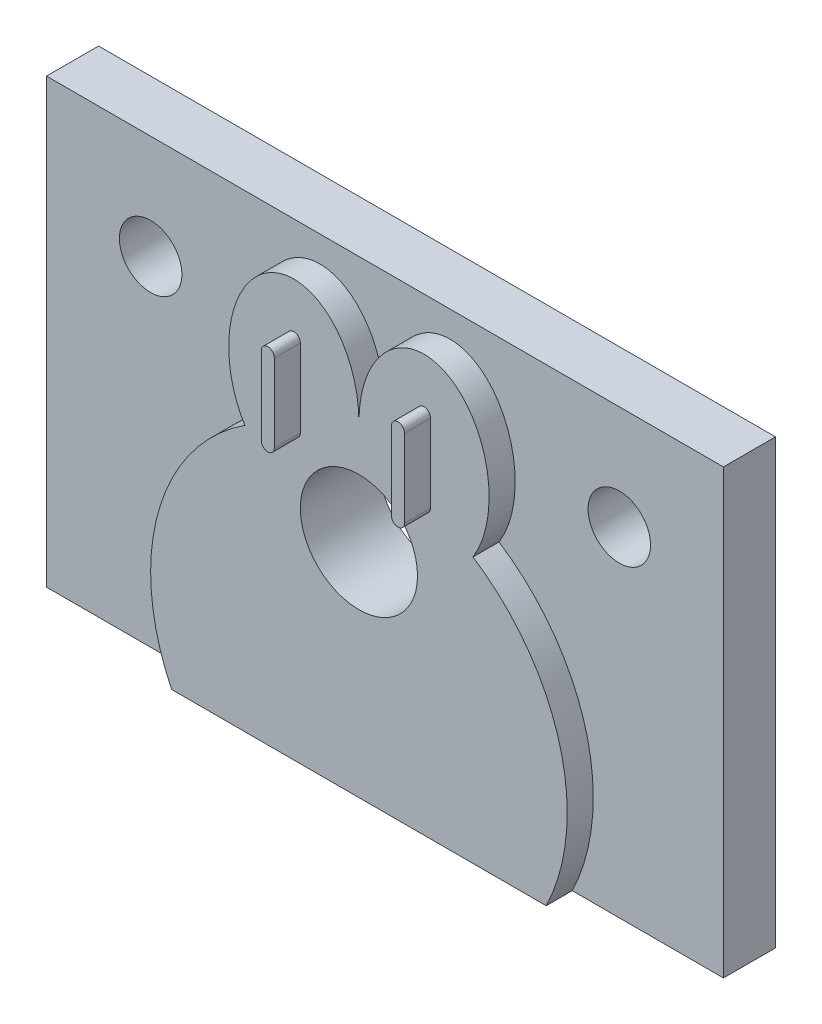
from build123d import *

# Parameters (mm, degrees)
EXTRUDE_1_DEPTH     = 1
SKETCH_2_R          = 2.25
EXTRUDE_2_DEPTH     = 1
SKETCH_4_W          = 26
SKETCH_4_H          = 17
SKETCH_4_R          = 1.2
EXTRUDE_3_DEPTH     = 2
SKETCH_5_R          = 2.25
CUT_EXTRUDE_2_DEPTH = 17.039015066


with BuildPart() as part:
    # ｽｹｯﾁ1 → ﾎﾞｽ - 押し出し1 (new body)
    with BuildSketch(Plane.XY):
        with BuildLine():
            Line((-7.193747285, -8.5), (7.193747285, -8.5))
            ThreePointArc((7.193747285, -8.5), (7.711759644, -2.871910907), (4.380673271, 1.694004907))
            add(Edge.make_bspline(
                [(4.380673271, 1.694004907), (6.759725445, 5.496905833), (3.379862723, 7.276072269), (0, 9.055238706), (0, 4)],
                knots=[0.851499657, 0.851499657, 0.851499657, 2.781944319, 2.781944319, 4.71238898, 4.71238898, 4.71238898], degree=2, weights=[1, 0.569234095, 1, 0.569234095, 1]))
            add(Edge.make_bspline(
                [(0, 4), (0, 9.055238706), (-3.379862723, 7.276072269), (-6.759725445, 5.496905833), (-4.380673271, 1.694004907)],
                knots=[1.570796327, 1.570796327, 1.570796327, 3.501240988, 3.501240988, 5.43168565, 5.43168565, 5.43168565], degree=2, weights=[1, 0.569234095, 1, 0.569234095, 1]))
            ThreePointArc((-4.380673271, 1.694004907), (-7.711759644, -2.871910907), (-7.193747285, -8.5))
        make_face()
    extrude(amount=EXTRUDE_1_DEPTH)

    # ｽｹｯﾁ2 → ﾎﾞｽ - 押し出し2 (add)
    with BuildSketch(Plane.XY.offset(1)):
        Circle(SKETCH_2_R)
        with BuildLine():
            Line((-2.75, 2.5), (-2.75, 5.5))
            ThreePointArc((-2.75, 5.5), (-2.5, 5.75), (-2.25, 5.5))
            Line((-2.25, 5.5), (-2.25, 2.5))
            ThreePointArc((-2.25, 2.5), (-2.5, 2.25), (-2.75, 2.5))
        make_face()
        with BuildLine():
            Line((2.25, 2.5), (2.25, 5.5))
            ThreePointArc((2.25, 5.5), (2.5, 5.75), (2.75, 5.5))
            Line((2.75, 5.5), (2.75, 2.5))
            ThreePointArc((2.75, 2.5), (2.5, 2.25), (2.25, 2.5))
        make_face()
    extrude(amount=EXTRUDE_2_DEPTH)

    # ｽｹｯﾁ4 → ﾎﾞｽ - 押し出し3 (add)
    with BuildSketch(Plane(origin=(0, 0, 0), x_dir=(-1, 0, 0), z_dir=(0, 0, -1))):
        Rectangle(SKETCH_4_W, SKETCH_4_H)
        with Locations((-9, 4.5)):
            Circle(SKETCH_4_R, mode=Mode.SUBTRACT)
        with Locations((9, 4.5)):
            Circle(SKETCH_4_R, mode=Mode.SUBTRACT)
    extrude(amount=EXTRUDE_3_DEPTH)

    # ｽｹｯﾁ5 → ｶｯﾄ - 押し出し2 (cut, through all)
    with BuildSketch(Plane.XY.offset(2)):
        Circle(SKETCH_5_R)
    extrude(amount=-CUT_EXTRUDE_2_DEPTH, mode=Mode.SUBTRACT)


solid = part.part
